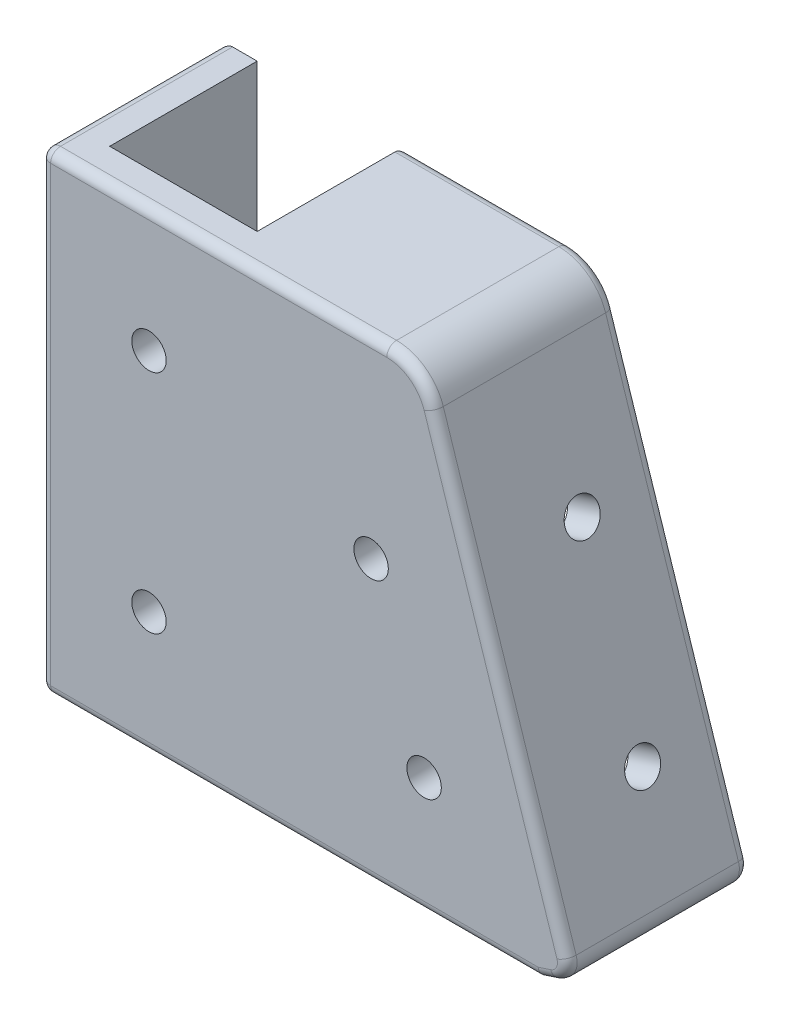
from build123d import *

# Parameters (mm, degrees)
BOSS_EXTRUDE1_DEPTH = 18.5
SKETCH2_W           = 15
SKETCH2_H           = 48
CUT_EXTRUDE1_DEPTH  = 15
SKETCH3_R           = 1.75
CUT_EXTRUDE2_DEPTH  = 3.5
SKETCH4_R           = 1.75
CUT_EXTRUDE3_DEPTH  = 4
SKETCH5_R           = 1.75
CUT_EXTRUDE4_DEPTH  = 4
CUT_EXTRUDE5_DEPTH  = 19
FILLET1_R           = 2
FILLET2_R           = 5
FILLET3_R           = 1


with BuildPart() as part:
    # Sketch1 → Boss-Extrude1 (new body)
    with BuildSketch(Plane.XY):
        Polygon((18.13055467, 13.619032779), (33.726700089, -34.380967221), (1.324021324, -34.380967221), (-20.675978676, -34.380967221), (-20.675978676, 13.619032779), align=None)
    extrude(amount=BOSS_EXTRUDE1_DEPTH)

    # Sketch2 → Cut-Extrude1 (cut)
    with BuildSketch(Plane.XY):
        with Locations((-9.675978676, -10.380967221)):
            Rectangle(SKETCH2_W, SKETCH2_H)
        Polygon((30.046582304, -34.380967221), (16.17981691, 8.296548347), (1.913969166, 3.661293431), (14.274648941, -34.380967221), align=None)
    extrude(amount=CUT_EXTRUDE1_DEPTH, mode=Mode.SUBTRACT)

    # Sketch3 → Cut-Extrude2 (cut)
    with BuildSketch(Plane(origin=(20.401774067, 6.628938232, 0), x_dir=(0, 0, -1), z_dir=(0.9510565162951533, 0.3090169943749487, 0))):
        with Locations(Location((-7.5, -29.483147467, 0), (0, 0, 90))):
            Circle(SKETCH3_R)
        with Locations(Location((-7.5, -9.609352023, 0), (0, 0, 90))):
            Circle(SKETCH3_R)
    extrude(amount=-CUT_EXTRUDE2_DEPTH, mode=Mode.SUBTRACT)

    # Sketch4 → Cut-Extrude3 (cut)
    with BuildSketch(Plane(origin=(0, 0, 18.5), x_dir=(-1, 0, 0), z_dir=(0, 0, -1))):
        with Locations(Location((-18.297903193, -22.492760767, 0), (0, 0, 180))):
            Circle(SKETCH4_R)
        with Locations(Location((-12.909605467, -5.909285565, 0), (0, 0, 180))):
            Circle(SKETCH4_R)
        with Locations(Location((9.675978676, 1.119032779, 0), (0, 0, 180))):
            Circle(SKETCH4_R)
        with Locations(Location((9.675978676, -21.880967221, 0), (0, 0, 180))):
            Circle(SKETCH4_R)
    extrude(amount=CUT_EXTRUDE3_DEPTH, mode=Mode.SUBTRACT)

    # Sketch5 → Cut-Extrude4 (cut)
    with BuildSketch(Plane.ZY.offset(20.675978676)):
        with Locations(Location((7.5, -21.880967221, 0), (0, 0, 270))):
            Circle(SKETCH5_R)
        with Locations(Location((7.5, 1.119032779, 0), (0, 0, 270))):
            Circle(SKETCH5_R)
    extrude(amount=-CUT_EXTRUDE4_DEPTH, mode=Mode.SUBTRACT)

    # Sketch6 → Cut-Extrude5 (cut)
    with BuildSketch(Plane.XY.offset(18.5)):
        Polygon((30.046582304, -34.380967221), (33.375280111, -33.29940774), (33.726700089, -34.380967221), align=None)
    extrude(amount=-CUT_EXTRUDE5_DEPTH, mode=Mode.SUBTRACT)

    # Fillet1
    fillet1_edges = [part.edges().sort_by_distance(p)[0] for p in [
        (33.375280111, -33.29940774, 9.25),
    ]]
    fillet(fillet1_edges, radius=FILLET1_R)

    # Fillet2
    fillet2_edges = [part.edges().sort_by_distance(p)[0] for p in [
        (18.13055467, 13.619032779, 9.25),
    ]]
    fillet(fillet2_edges, radius=FILLET2_R)

    # Fillet3
    fillet3_edges = [part.edges().sort_by_distance(p)[0] for p in [
        (30.759874691, -34.149204475, 0),
        (32.637146138, -32.923309696, 0),
        (6.160931677, 13.619032779, 0),
        (17.436768291, 12.664117751, 0),
        (30.759874691, -34.149204475, 18.5),
        (32.637146138, -32.923309696, 18.5),
        (-3.089068323, 13.619032779, 18.5),
        (17.436768291, 12.664117751, 18.5),
        (-20.675978676, 13.619032779, 9.25),
        (-20.675978676, -34.380967221, 9.25),
        (-20.675978676, -10.380967221, 0),
        (6.049335132, -34.380967221, 0),
        (-2.175978676, -10.380967221, 0),
        (26.005185367, -10.616588478, 0),
        (-20.675978676, -10.380967221, 18.5),
        (4.685301814, -34.380967221, 18.5),
        (26.005185367, -10.616588478, 18.5),
    ]]
    fillet(fillet3_edges, radius=FILLET3_R)


solid = part.part
